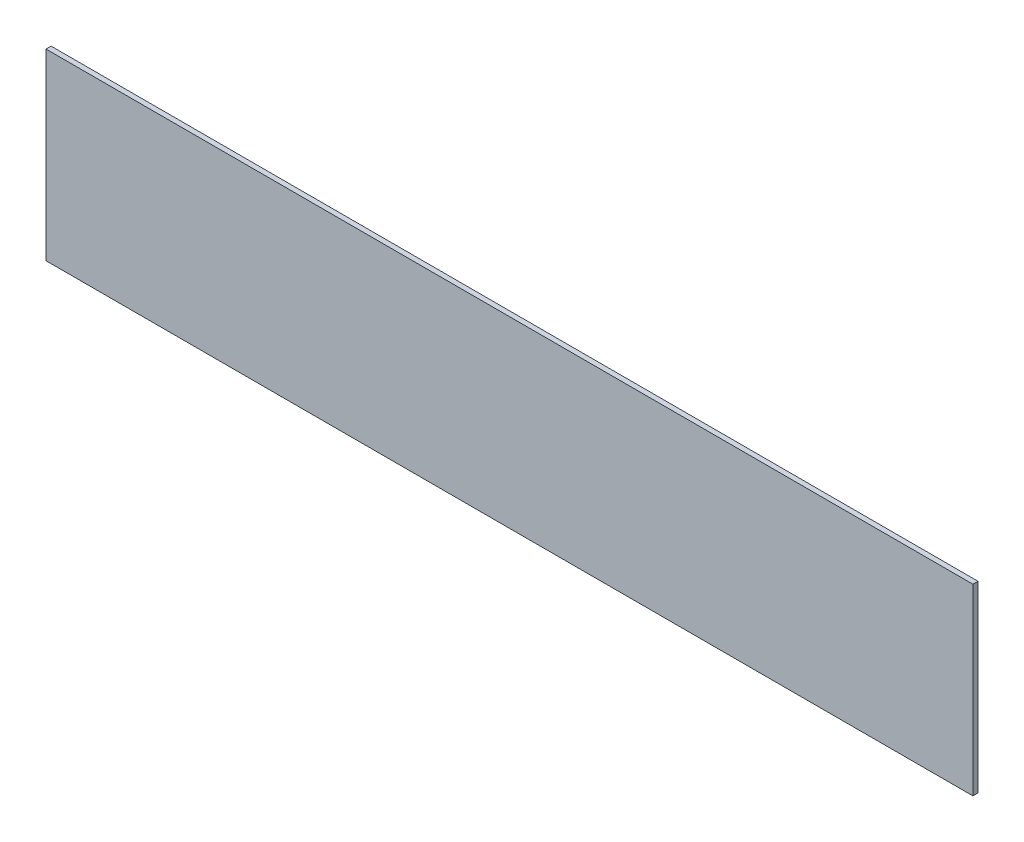
from build123d import *

# Parameters (mm, degrees)
TOPPING_KLAPE_KAT2_KULP_CUKURU_1_START = 26
SKETCH1_W                              = 182
SKETCH1_H                              = 36
TOPPING_KLAPE_KAT2_KULP_CUKURU_1_DEPTH = 1


with BuildPart() as part:
    # Sketch1 → TOPPING_klape_kat2_kulp_cukuru_1 (new body)
    with BuildSketch(Plane.XY.offset(TOPPING_KLAPE_KAT2_KULP_CUKURU_1_START)):
        with Locations((350, 1355)):
            Rectangle(SKETCH1_W, SKETCH1_H)
    extrude(amount=TOPPING_KLAPE_KAT2_KULP_CUKURU_1_DEPTH)


solid = part.part
